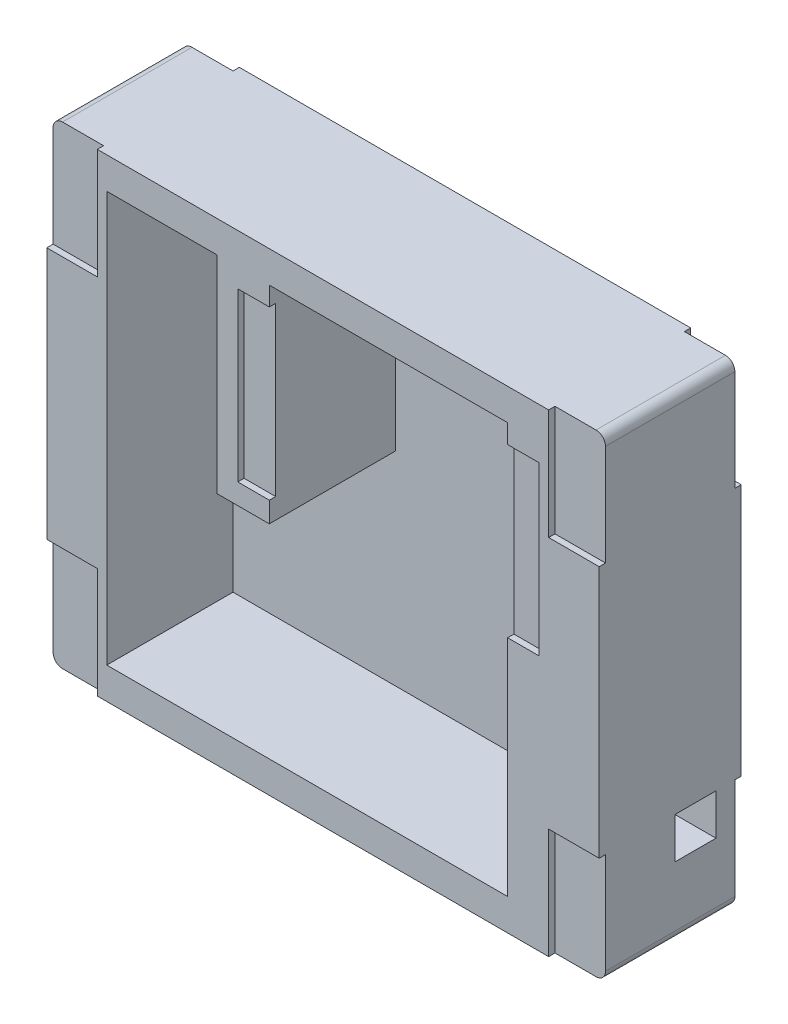
from build123d import *

# Parameters (mm, degrees)
SKETCH2_W           = 175
SKETCH2_H           = 150
BOSS_EXTRUDE1_DEPTH = 45
CUT_EXTRUDE1_DEPTH  = 40
SKETCH5_W           = 13
SKETCH5_H           = 13
CUT_EXTRUDE3_DEPTH  = 50
SKETCH6_W           = 10
SKETCH6_H           = 53
CUT_EXTRUDE4_DEPTH  = 2
SKETCH7_W           = 35
SKETCH7_H           = 130
CUT_EXTRUDE5_DEPTH  = 40
SKETCH9_W           = 16
SKETCH9_H           = 35
CUT_EXTRUDE6_DEPTH  = 2
SKETCH10_W          = 16.5
SKETCH10_H          = 24.5
CUT_EXTRUDE7_DEPTH  = 40
SKETCH11_W          = 16
SKETCH11_H          = 35
CUT_EXTRUDE8_DEPTH  = 2
FILLET1_R           = 3


with BuildPart() as part:
    # Sketch2 → Boss-Extrude1 (new body)
    with BuildSketch(Plane.XY):
        with Locations((-87.5, -75)):
            Rectangle(SKETCH2_W, SKETCH2_H)
    extrude(amount=BOSS_EXTRUDE1_DEPTH)

    # Sketch3 → Cut-Extrude1 (cut)
    with BuildSketch(Plane.XY.offset(45)):
        Polygon((-104.5, -10), (-29, -10), (-29, -140), (-156, -140), (-156, -100), (-104.5, -100), align=None)
    extrude(amount=-CUT_EXTRUDE1_DEPTH, mode=Mode.SUBTRACT)

    # Sketch5 → Cut-Extrude3 (cut)
    with BuildSketch(Plane(origin=(0, 0, 0), x_dir=(0, 0, -1), z_dir=(1, 0, 0))):
        with Locations((-14.5, -121.5)):
            Rectangle(SKETCH5_W, SKETCH5_H)
    extrude(amount=-CUT_EXTRUDE3_DEPTH, mode=Mode.SUBTRACT)

    # Sketch6 → Cut-Extrude4 (cut)
    with BuildSketch(Plane.XY.offset(45)):
        with Locations((-109.5, -42.5)):
            Rectangle(SKETCH6_W, SKETCH6_H)
        with Locations((-24, -42.5)):
            Rectangle(SKETCH6_W, SKETCH6_H)
    extrude(amount=-CUT_EXTRUDE4_DEPTH, mode=Mode.SUBTRACT)

    # Sketch7 → Cut-Extrude5 (cut)
    with BuildSketch(Plane.XY.offset(45)):
        with Locations((-138.5, -75)):
            Rectangle(SKETCH7_W, SKETCH7_H)
    extrude(amount=-CUT_EXTRUDE5_DEPTH, mode=Mode.SUBTRACT)

    # Sketch9 → Cut-Extrude6 (cut)
    with BuildSketch(Plane.XY.offset(45)):
        with Locations((-167, -17.5)):
            Rectangle(SKETCH9_W, SKETCH9_H)
        with Locations((-167, -132.5)):
            Rectangle(SKETCH9_W, SKETCH9_H)
        with Locations((-8, -132.5)):
            Rectangle(SKETCH9_W, SKETCH9_H)
        with Locations((-8, -17.5)):
            Rectangle(SKETCH9_W, SKETCH9_H)
    extrude(amount=-CUT_EXTRUDE6_DEPTH, mode=Mode.SUBTRACT)

    # Sketch10 → Cut-Extrude7 (cut)
    with BuildSketch(Plane.XY.offset(45)):
        with Locations((-112.75, -87.75)):
            Rectangle(SKETCH10_W, SKETCH10_H)
    extrude(amount=-CUT_EXTRUDE7_DEPTH, mode=Mode.SUBTRACT)

    # Sketch11 → Cut-Extrude8 (cut)
    with BuildSketch(Plane(origin=(0, 0, 0), x_dir=(-1, 0, 0), z_dir=(0, 0, -1))):
        with Locations((8, -17.5)):
            Rectangle(SKETCH11_W, SKETCH11_H)
        with Locations((8, -132.5)):
            Rectangle(SKETCH11_W, SKETCH11_H)
        with Locations((167, -132.5)):
            Rectangle(SKETCH11_W, SKETCH11_H)
        with Locations((167, -17.5)):
            Rectangle(SKETCH11_W, SKETCH11_H)
    extrude(amount=-CUT_EXTRUDE8_DEPTH, mode=Mode.SUBTRACT)

    # Fillet1
    fillet1_edges = [part.edges().sort_by_distance(p)[0] for p in [
        (0, -150, 22.5),
        (-175, -150, 22.5),
        (-175, 0, 22.5),
        (0, 0, 22.5),
    ]]
    fillet(fillet1_edges, radius=FILLET1_R)


solid = part.part
